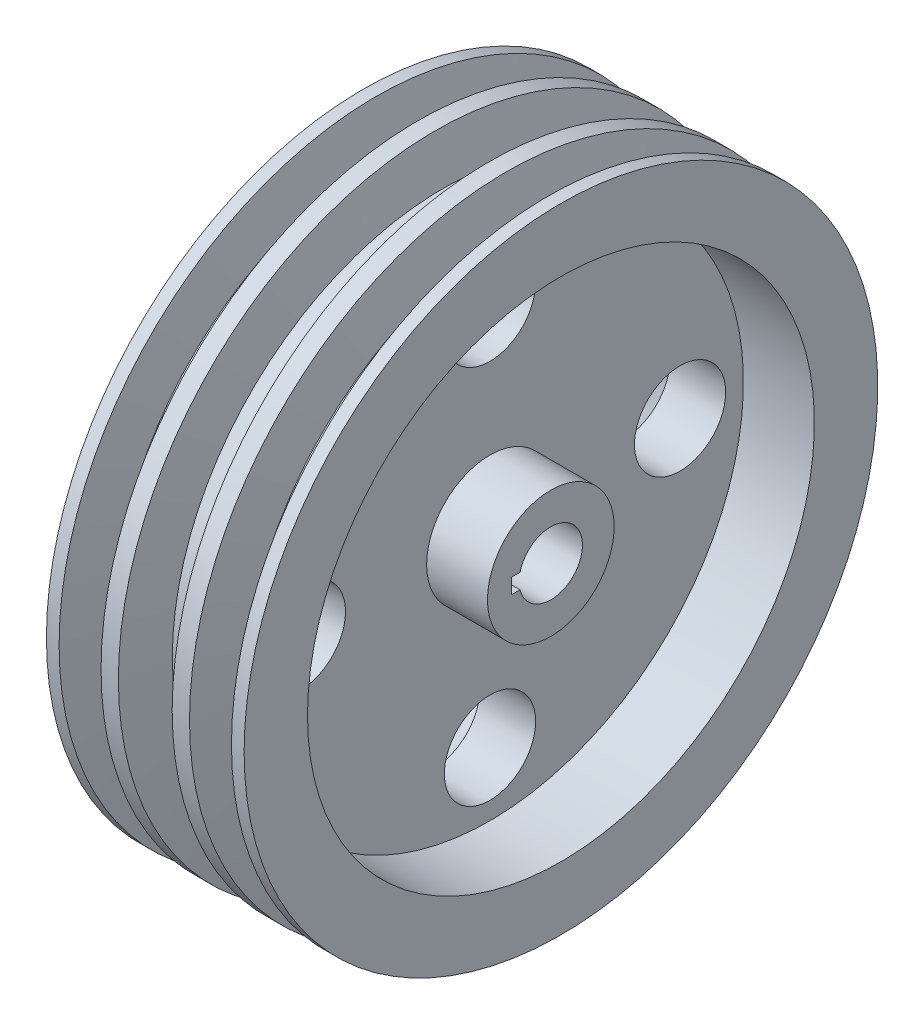
from build123d import *

# Parameters (mm, degrees)
CUT_EXTRUDE1_DEPTH      = 184.711730709
CUT_EXTRUDE1_DEPTH_BACK = 184.711730709
SKETCH2_R               = 18


with BuildPart() as part:
    # Sketch1 → Revolve2 (revolve)
    with BuildSketch(Plane.XY, mode=Mode.PRIVATE) as revolve2_sk:
        Polygon((17.448535783, 125), (20.724267892, 107), (30.724267892, 107), (34, 125), (39, 125), (39, 100), (11, 100), (11, 25), (35, 25), (35, 12.5), (0, 12.5), (-35, 12.5), (-35, 25), (-11, 25), (-11, 100), (-39, 100), (-39, 125), (-34, 125), (-30.724267892, 107), (-20.724267892, 107), (-17.448535783, 125), (-10.611364858, 125), (-7.33563275, 107), (7.33563275, 107), (10.611364858, 125), align=None)
    revolve(revolve2_sk.sketch.rotate(Axis((-121.58529461, 0, 0), (1, 0, 0)), 90), axis=Axis((-121.58529461, 0, 0), (1, 0, 0)))

    # Sketch2 → Cut-Extrude1 (cut, two sides: drawn at the far end of the back side and taken through both)
    with BuildSketch(Plane.ZY.offset(11).offset(-CUT_EXTRUDE1_DEPTH_BACK)):
        with Locations(Location((0, 75, 0), (0, 0, 180))):
            Circle(SKETCH2_R)
        with Locations(Location((75, 0, 0), (0, 0, 180))):
            Circle(SKETCH2_R)
        with Locations(Location((0, -75, 0), (0, 0, 180))):
            Circle(SKETCH2_R)
        with Locations(Location((-75, 0, 0), (0, 0, 180))):
            Circle(SKETCH2_R)
        with BuildLine():
            Line((15.5, -3), (15.5, 3))
            Line((15.5, 3), (12.1346611, 3))
            ThreePointArc((12.1346611, 3), (-12.5, 0), (12.1346611, -3))
            Line((12.1346611, -3), (15.5, -3))
        make_face()
    extrude(amount=CUT_EXTRUDE1_DEPTH + CUT_EXTRUDE1_DEPTH_BACK, mode=Mode.SUBTRACT)


solid = part.part
